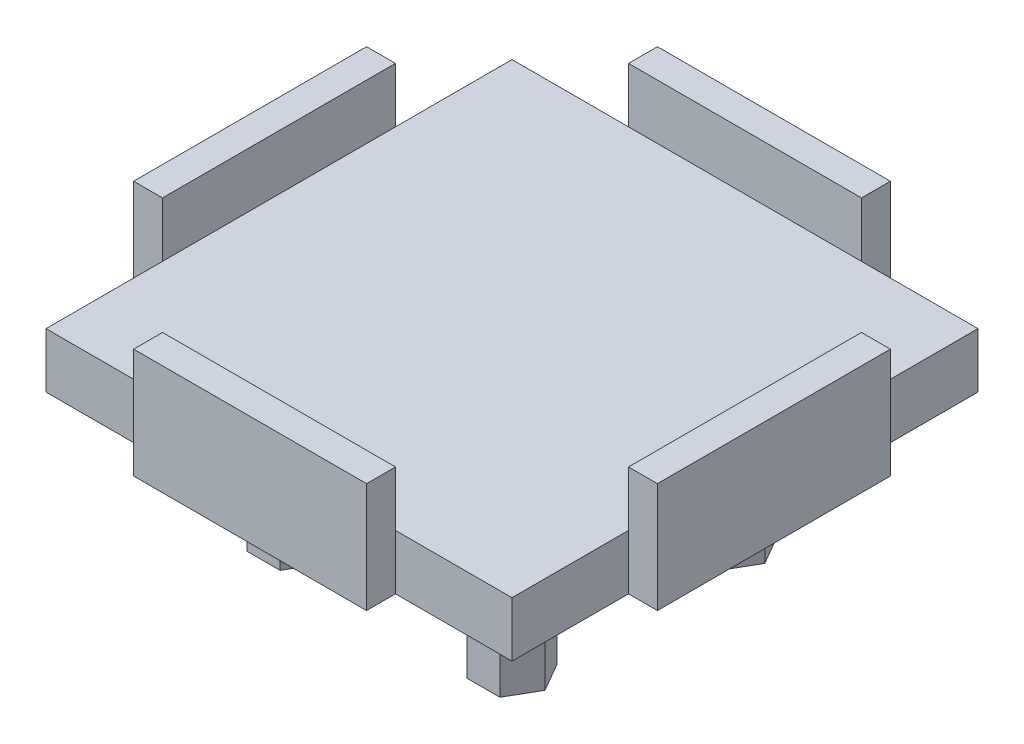
from build123d import *

# Parameters (mm, degrees)
SKETCH1_W                = 42.4
SKETCH1_H                = 42.4
BOSS_EXTRUDE1_DEPTH      = 5
BOSS_EXTRUDE2_DEPTH      = 5
BOSS_EXTRUDE2_DEPTH_BACK = 5
SKETCH3_W                = 2.630753666
SKETCH3_H                = 21.2
SKETCH3_W_2              = 21.2
SKETCH3_H_2              = 2.630753666
BOSS_EXTRUDE3_DEPTH      = 12


with BuildPart() as part:
    # Sketch1 → Boss-Extrude1 (new body)
    with BuildSketch(Plane(origin=(0, 0, 0), x_dir=(1, 0, 0), z_dir=(0, 1, 0))):
        with Locations((21.2, 21.2)):
            Rectangle(SKETCH1_W, SKETCH1_H)
    extrude(amount=BOSS_EXTRUDE1_DEPTH)

    # Sketch3 → Boss-Extrude2 (add, two sides: drawn at the far end of the back side and taken through both)
    with BuildSketch(Plane(origin=(0, 5, 0), x_dir=(1, 0, 0), z_dir=(0, 1, 0)).offset(-BOSS_EXTRUDE2_DEPTH_BACK)):
        with Locations((43.715376833, 21.2)):
            Rectangle(SKETCH3_W, SKETCH3_H)
        with Locations((21.2, 43.715376833)):
            Rectangle(SKETCH3_W_2, SKETCH3_H_2)
        with Locations((21.2, -1.315376833)):
            Rectangle(SKETCH3_W_2, SKETCH3_H_2)
        with Locations((-1.315376833, 21.2)):
            Rectangle(SKETCH3_W, SKETCH3_H)
    extrude(amount=BOSS_EXTRUDE2_DEPTH + BOSS_EXTRUDE2_DEPTH_BACK)

    # Sketch4 → Boss-Extrude3 (add)
    with BuildSketch(Plane.XZ):
        Polygon((32.7, -8.601923789), (29.7, -8.601923789), (28.2, -11.2), (29.7, -13.798076211), (32.7, -13.798076211), (34.2, -11.2), align=None)
        Polygon((9.7, -8.601923789), (8.2, -11.2), (9.7, -13.798076211), (12.7, -13.798076211), (14.2, -11.2), (12.7, -8.601923789), align=None)
        Polygon((32.7, -28.601923789), (29.7, -28.601923789), (28.2, -31.2), (29.7, -33.798076211), (32.7, -33.798076211), (34.2, -31.2), align=None)
        Polygon((12.7, -28.601923789), (9.7, -28.601923789), (8.2, -31.2), (9.7, -33.798076211), (12.7, -33.798076211), (14.2, -31.2), align=None)
    extrude(amount=BOSS_EXTRUDE3_DEPTH)


solid = part.part
